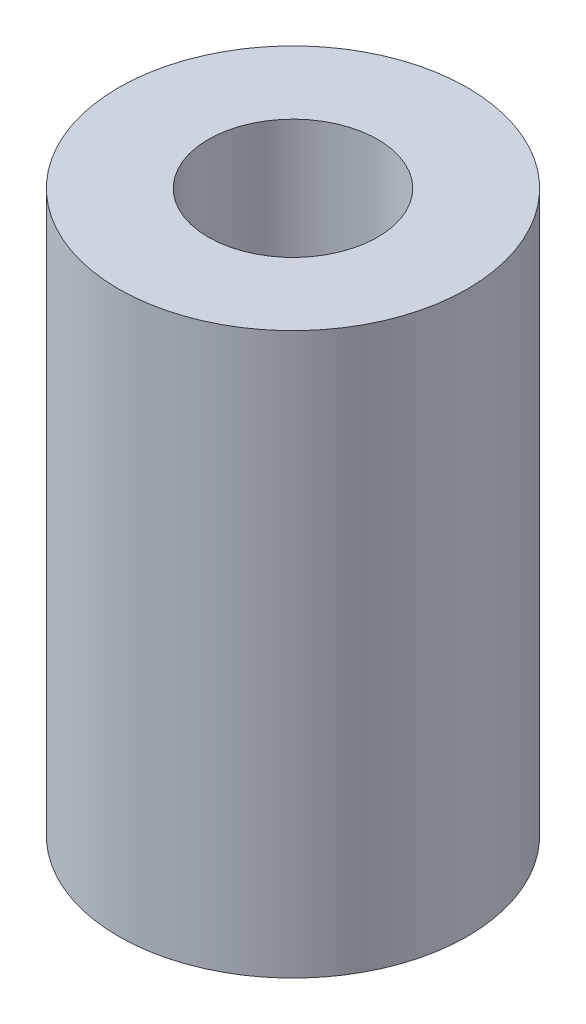
from build123d import *

# Parameters (mm, degrees)
SKETCH1_R           = 3.5
SKETCH1_R_2         = 1.7
BOSS_EXTRUDE1_DEPTH = 11.252


with BuildPart() as part:
    # Sketch1 → Boss-Extrude1 (new body)
    with BuildSketch(Plane(origin=(0, 0, 0), x_dir=(1, 0, 0), z_dir=(0, 1, 0))):
        with Locations(Location((0, 0, 0), (0, 0, 270))):
            Circle(SKETCH1_R)
        with Locations(Location((0, 0, 0), (0, 0, 270))):
            Circle(SKETCH1_R_2, mode=Mode.SUBTRACT)
    extrude(amount=BOSS_EXTRUDE1_DEPTH)


solid = part.part
